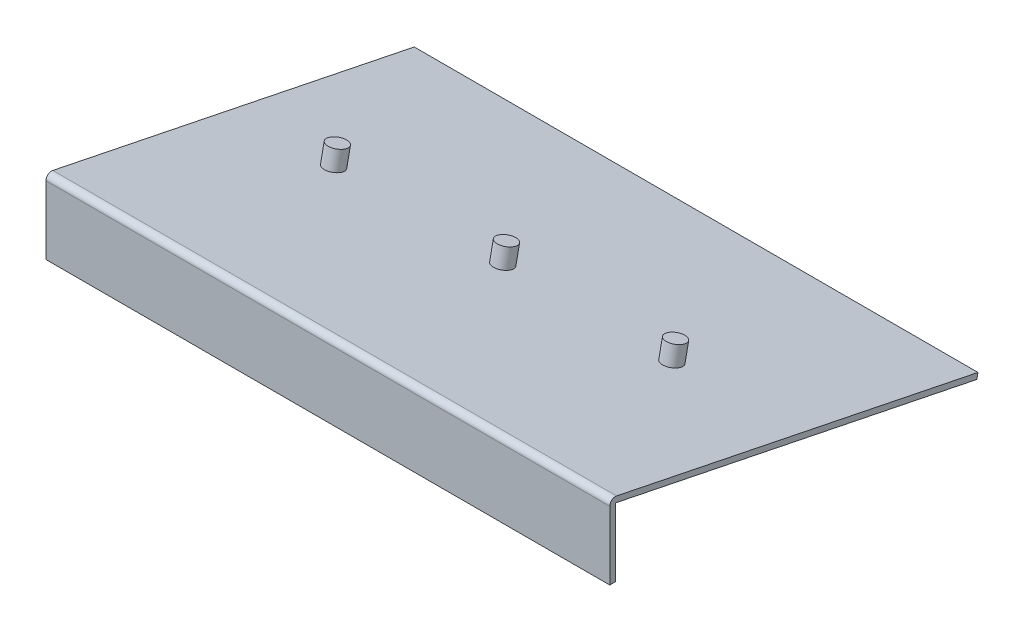
from build123d import *

# Parameters (mm, degrees)
BOSS_EXTRUDE2_DEPTH = 300
SKETCH3_R           = 5
BOSS_EXTRUDE3_DEPTH = 10


with BuildPart() as part:
    # Sketch2 → Boss-Extrude2 (new body)
    with BuildSketch(Plane(origin=(0, 0, 0), x_dir=(0, 0, -1), z_dir=(1, 0, 0))):
        with BuildLine():
            Line((195.359179423, -2.939387691), (3, 36.325765386))
            Line((3, 36.325765386), (3, 0))
            Line((3, 0), (0, 0))
            Line((0, 0), (0, 36.325765386))
            ThreePointArc((0, 36.325765386), (1.102633404, 38.649555394), (3.6, 39.265153077))
            Line((3.6, 39.265153077), (195.959179423, 0))
            Line((195.959179423, 0), (195.359179423, -2.939387691))
        make_face()
    extrude(amount=BOSS_EXTRUDE2_DEPTH)

    # Sketch3 → Boss-Extrude3 (add)
    with BuildSketch(Plane(origin=(0, 38.4, -7.838367177), x_dir=(1, 0, 0), z_dir=(0, 0.9797958971132714, -0.19999999999999998))):
        with Locations(Location((53.264501209, 93.837117307, 0), (0, 0, 90))):
            Circle(SKETCH3_R)
        with Locations(Location((143.264501209, 93.837117307, 0), (0, 0, 90))):
            Circle(SKETCH3_R)
        with Locations(Location((233.264501209, 93.837117307, 0), (0, 0, 90))):
            Circle(SKETCH3_R)
    extrude(amount=BOSS_EXTRUDE3_DEPTH)


solid = part.part
